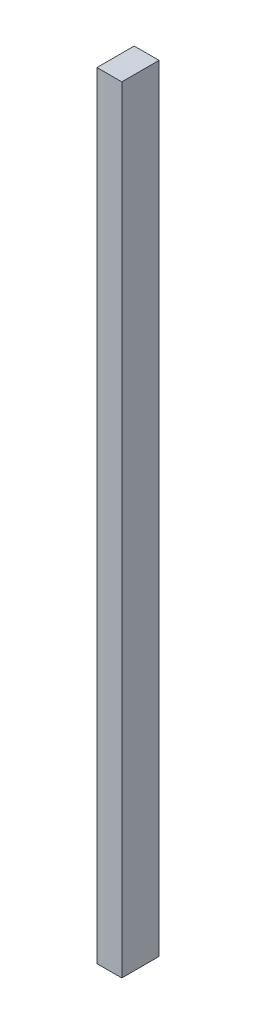
from build123d import *

# Parameters (mm, degrees)
SKETCH1_W           = 8
SKETCH1_H           = 12
BOSS_EXTRUDE1_DEPTH = 250


with BuildPart() as part:
    # Sketch1 → Boss-Extrude1 (new body)
    with BuildSketch(Plane(origin=(0, 0, 0), x_dir=(1, 0, 0), z_dir=(0, 1, 0))):
        Rectangle(SKETCH1_W, SKETCH1_H)
    extrude(amount=BOSS_EXTRUDE1_DEPTH)


solid = part.part
